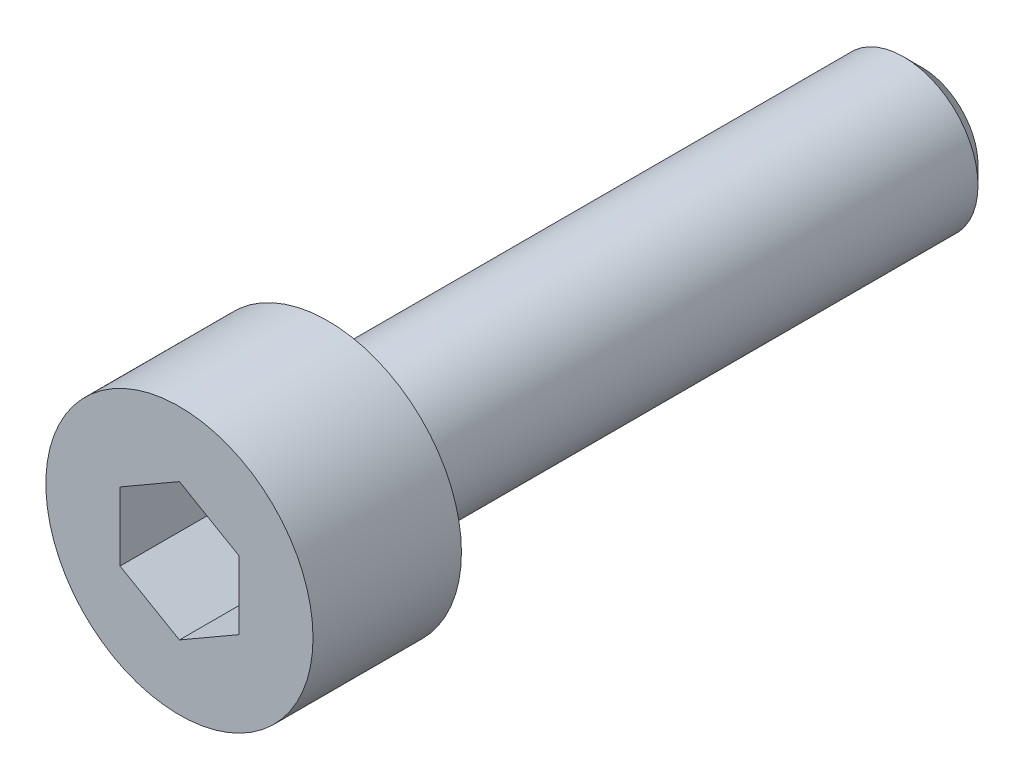
from build123d import *

# Parameters (mm, degrees)
SKETCH1_R           = 2.25
BOSS_EXTRUDE1_DEPTH = 2.5
SKETCH2_R           = 1.25
BOSS_EXTRUDE2_DEPTH = 10
CHAMFER1_SIZE       = 0.3
CUT_EXTRUDE1_DEPTH  = 2


with BuildPart() as part:
    # Sketch1 → Boss-Extrude1 (new body)
    with BuildSketch(Plane.XY):
        Circle(SKETCH1_R)
    extrude(amount=BOSS_EXTRUDE1_DEPTH)

    # Sketch2 → Boss-Extrude2 (add)
    with BuildSketch(Plane(origin=(0, 0, 0), x_dir=(-1, 0, 0), z_dir=(0, 0, -1))):
        with Locations(Location((0, 0, 0), (0, 0, 180))):
            Circle(SKETCH2_R)
    extrude(amount=BOSS_EXTRUDE2_DEPTH)

    # Chamfer1
    chamfer1_edges = [part.edges().sort_by_distance(p)[0] for p in [
        (-1.25, 0, -10),
    ]]
    chamfer(chamfer1_edges, length=CHAMFER1_SIZE)

    # Sketch3 → Cut-Extrude1 (cut)
    with BuildSketch(Plane.XY.offset(2.5)):
        Polygon((0, 1.154700538), (-1, 0.577350269), (-1, -0.577350269), (0, -1.154700538), (1, -0.577350269), (1, 0.577350269), align=None)
    extrude(amount=-CUT_EXTRUDE1_DEPTH, mode=Mode.SUBTRACT)


solid = part.part
